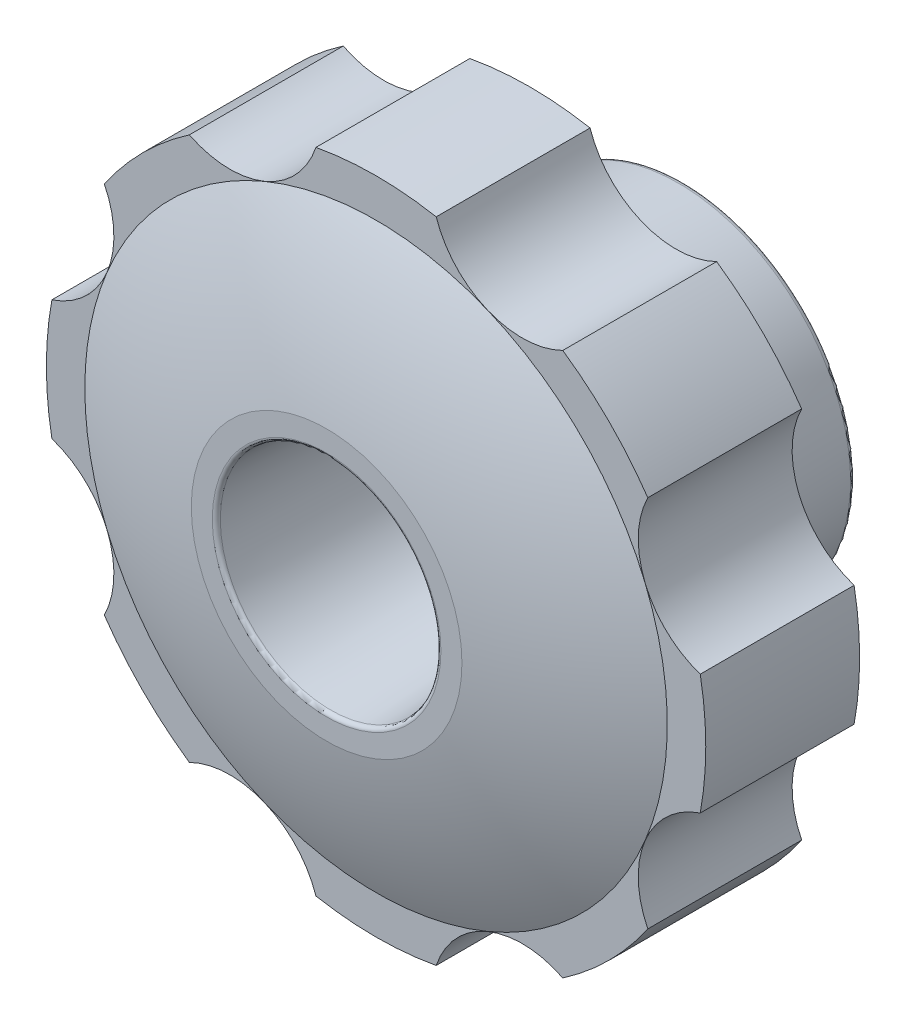
from build123d import *

# Parameters (mm, degrees)
C3A_CAVITYPRISM_DEPTH  = 11.938
SK_C3_RIBS_W           = 19.05
SK_C3_RIBS_H           = 1.27
SK_C3_RIBS_W_2         = 1.27
SK_C3_RIBS_H_2         = 19.05
C3D_RIBS_DEPTH         = 11.938
C2_SCALLOPS_DEPTH      = 47.436868801
C2_SCALLOPS_DEPTH_BACK = 47.436868801
SK_C2_SCALLOPS_R       = 8.382
SK_C5_RIDGE_W          = 3.0426914
SK_C5_RIDGE_H          = 0.381


with BuildPart() as part:
    # SK_C1_profile → C1_MainRevolve (revolve)
    with BuildSketch(Plane(origin=(0, 0, 0), x_dir=(1, 0, 0), z_dir=(0, 1, 0)), mode=Mode.PRIVATE) as c1_mainrevolve_sk:
        with BuildLine():
            Line((0, 17.272), (15.3929334, 17.272))
            ThreePointArc((15.3929334, 17.272), (15.742617524, 17.13249018), (15.900237204, 16.790586666))
            Line((15.900237204, 16.790586666), (16.620448253, 3.048))
            Line((16.620448253, 3.048), (30.48, 3.048))
            Line((30.48, 3.048), (30.48, -11.176))
            Line((30.48, -11.176), (26.924, -11.176))
            ThreePointArc((26.924, -11.176), (19.874523429, -13.957256168), (12.5108462, -15.748))
            Line((12.5108462, -15.748), (0, -15.748))
            Line((0, -15.748), (0, 17.272))
        make_face()
    revolve(c1_mainrevolve_sk.sketch.rotate(Axis((0, 0, -50.8), (0, 0, 1)), 180), axis=Axis((0, 0, -50.8), (0, 0, 1)))

    # SK_C3_Lci → C3a_CavityPrism (cut)
    with BuildSketch(Plane.XY.offset(-3.048)):
        with BuildLine():
            ThreePointArc((27.769715286, -4.872837874), (28.194, 0), (27.769715286, 4.872837874))
            ThreePointArc((27.769715286, 4.872837874), (23.466540126, 9.720159182), (23.081770695, 16.190537286))
            ThreePointArc((23.081770695, 16.190537286), (19.936168589, 19.936168589), (16.190537286, 23.081770695))
            ThreePointArc((16.190537286, 23.081770695), (9.720159182, 23.466540126), (4.872837874, 27.769715286))
            ThreePointArc((4.872837874, 27.769715286), (0, 28.194), (-4.872837874, 27.769715286))
            ThreePointArc((-4.872837874, 27.769715286), (-9.720159182, 23.466540126), (-16.190537286, 23.081770695))
            ThreePointArc((-16.190537286, 23.081770695), (-19.936168589, 19.936168589), (-23.081770695, 16.190537286))
            ThreePointArc((-23.081770695, 16.190537286), (-23.466540126, 9.720159182), (-27.769715286, 4.872837874))
            ThreePointArc((-27.769715286, 4.872837874), (-28.194, 0), (-27.769715286, -4.872837874))
            ThreePointArc((-27.769715286, -4.872837874), (-23.466540126, -9.720159182), (-23.081770695, -16.190537286))
            ThreePointArc((-23.081770695, -16.190537286), (-19.936168589, -19.936168589), (-16.190537286, -23.081770695))
            ThreePointArc((-16.190537286, -23.081770695), (-9.720159182, -23.466540126), (-4.872837874, -27.769715286))
            ThreePointArc((-4.872837874, -27.769715286), (0, -28.194), (4.872837874, -27.769715286))
            ThreePointArc((4.872837874, -27.769715286), (9.720159182, -23.466540126), (16.190537286, -23.081770695))
            ThreePointArc((16.190537286, -23.081770695), (19.936168589, -19.936168589), (23.081770695, -16.190537286))
            ThreePointArc((23.081770695, -16.190537286), (23.466540126, -9.720159182), (27.769715286, -4.872837874))
        make_face()
    extrude(amount=C3A_CAVITYPRISM_DEPTH, mode=Mode.SUBTRACT)


with BuildPart() as c3a_cavityprism_piece_1:
    # of the separate pieces the step leaves, piece 1, a body of its own (c3a_cavityprism_pieces)
    add(part.part.solids().sort_by_distance((-30.48, 0, -3.048))[0])

    # SK_C3_ceiling → C3b_CeilingRing (revolve)
    with BuildSketch(Plane(origin=(0, 0, 0), x_dir=(1, 0, 0), z_dir=(0, 1, 0)), mode=Mode.PRIVATE) as c3b_ceilingring_sk:
        Polygon((25.654, -6.604), (23.368, -8.89), (30.48, -8.89), (30.48, -6.604), align=None)
    revolve(c3b_ceilingring_sk.sketch.rotate(Axis((0, 0, -50.8), (0, 0, 1)), 180), axis=Axis((0, 0, -50.8), (0, 0, 1)))



with BuildPart() as c3a_cavityprism_piece_2:
    # of the separate pieces the step leaves, piece 2, a body of its own (c3a_cavityprism_pieces)
    add(part.part.solids().sort_by_distance((-15.3929334, 0, -17.272))[0])


with BuildPart() as c3a_cavityprism_piece_1_1:
    add(c3a_cavityprism_piece_1.part)

    add(c3a_cavityprism_piece_2.part)  # C3c_HubUp merges C3a_CavityPrism piece 2
    # SK_C3_hub → C3c_HubUp (revolve)
    with BuildSketch(Plane(origin=(0, 0, 0), x_dir=(1, 0, 0), z_dir=(0, 1, 0)), mode=Mode.PRIVATE) as c3c_hubup_sk:
        Polygon((0, 3.048), (16.620448253, 3.048), (17.246092322, -8.89), (0, -8.89), align=None)
    revolve(c3c_hubup_sk.sketch.rotate(Axis((0, 0, -50.8), (0, 0, 1)), 180), axis=Axis((0, 0, -50.8), (0, 0, 1)))

    # SK_C3_ribs → C3d_Ribs (add)
    with BuildSketch(Plane.XY.offset(-3.048)):
        with Locations((19.685, 0)):
            Rectangle(SK_C3_RIBS_W, SK_C3_RIBS_H)
        Polygon((7.633217703, 6.735192091), (21.103601885, 20.205576272), (20.205576272, 21.103601885), (6.735192091, 7.633217703), align=None)
        with Locations((0, 19.685)):
            Rectangle(SK_C3_RIBS_W_2, SK_C3_RIBS_H_2)
        Polygon((-6.735192091, 7.633217703), (-20.205576272, 21.103601885), (-21.103601885, 20.205576272), (-7.633217703, 6.735192091), align=None)
        with Locations((-19.685, 0)):
            Rectangle(SK_C3_RIBS_W, SK_C3_RIBS_H)
        Polygon((-7.633217703, -6.735192091), (-21.103601885, -20.205576272), (-20.205576272, -21.103601885), (-6.735192091, -7.633217703), align=None)
        with Locations((0, -19.685)):
            Rectangle(SK_C3_RIBS_W_2, SK_C3_RIBS_H_2)
        Polygon((6.735192091, -7.633217703), (20.205576272, -21.103601885), (21.103601885, -20.205576272), (7.633217703, -6.735192091), align=None)
    extrude(amount=C3D_RIBS_DEPTH)

    # SK_C2_scallops → C2_Scallops (cut, two sides: drawn at the far end of the back side and taken through both)
    with BuildSketch(Plane.XY.offset(-C2_SCALLOPS_DEPTH_BACK)):
        with Locations((32.618490775, 13.511021263)):
            Circle(SK_C2_SCALLOPS_R)
        with Locations((13.511021263, 32.618490775)):
            Circle(SK_C2_SCALLOPS_R)
        with Locations((-13.511021263, 32.618490775)):
            Circle(SK_C2_SCALLOPS_R)
        with Locations((-32.618490775, 13.511021263)):
            Circle(SK_C2_SCALLOPS_R)
        with Locations((-32.618490775, -13.511021263)):
            Circle(SK_C2_SCALLOPS_R)
        with Locations((-13.511021263, -32.618490775)):
            Circle(SK_C2_SCALLOPS_R)
        with Locations((13.511021263, -32.618490775)):
            Circle(SK_C2_SCALLOPS_R)
        with Locations((32.618490775, -13.511021263)):
            Circle(SK_C2_SCALLOPS_R)
    extrude(amount=C2_SCALLOPS_DEPTH + C2_SCALLOPS_DEPTH_BACK, mode=Mode.SUBTRACT)

    # SK_C4_bore → C4_Bore (revolve, cut)
    with BuildSketch(Plane(origin=(0, 0, 0), x_dir=(1, 0, 0), z_dir=(0, 1, 0)), mode=Mode.PRIVATE) as c4_bore_sk:
        with BuildLine():
            Line((0, 18.542), (6.746875, 18.542))
            Line((6.746875, 18.542), (6.746875, 4.572))
            Line((6.746875, 4.572), (9.144, 4.572))
            Line((9.144, 4.572), (10.1900228, -15.386939))
            ThreePointArc((10.1900228, -15.386939), (10.308227792, -15.643369045), (10.5704894, -15.748))
            Line((10.5704894, -15.748), (10.5704894, -18.288))
            Line((10.5704894, -18.288), (0, -18.288))
            Line((0, -18.288), (0, 18.542))
        make_face()
    revolve(c4_bore_sk.sketch.rotate(Axis((0, 0, -50.8), (0, 0, 1)), 180), axis=Axis((0, 0, -50.8), (0, 0, 1)), mode=Mode.SUBTRACT)

    # SK_C5_ridge → C5_Ridge (revolve)
    with BuildSketch(Plane(origin=(0, 0, 0), x_dir=(1, 0, 0), z_dir=(0, 1, 0)), mode=Mode.PRIVATE) as c5_ridge_sk:
        with Locations((11.3109375, 17.4625)):
            Rectangle(SK_C5_RIDGE_W, SK_C5_RIDGE_H)
    revolve(c5_ridge_sk.sketch.rotate(Axis((0, 0, -50.8), (0, 0, 1)), 180), axis=Axis((0, 0, -50.8), (0, 0, 1)))


solid = c3a_cavityprism_piece_1_1.part
